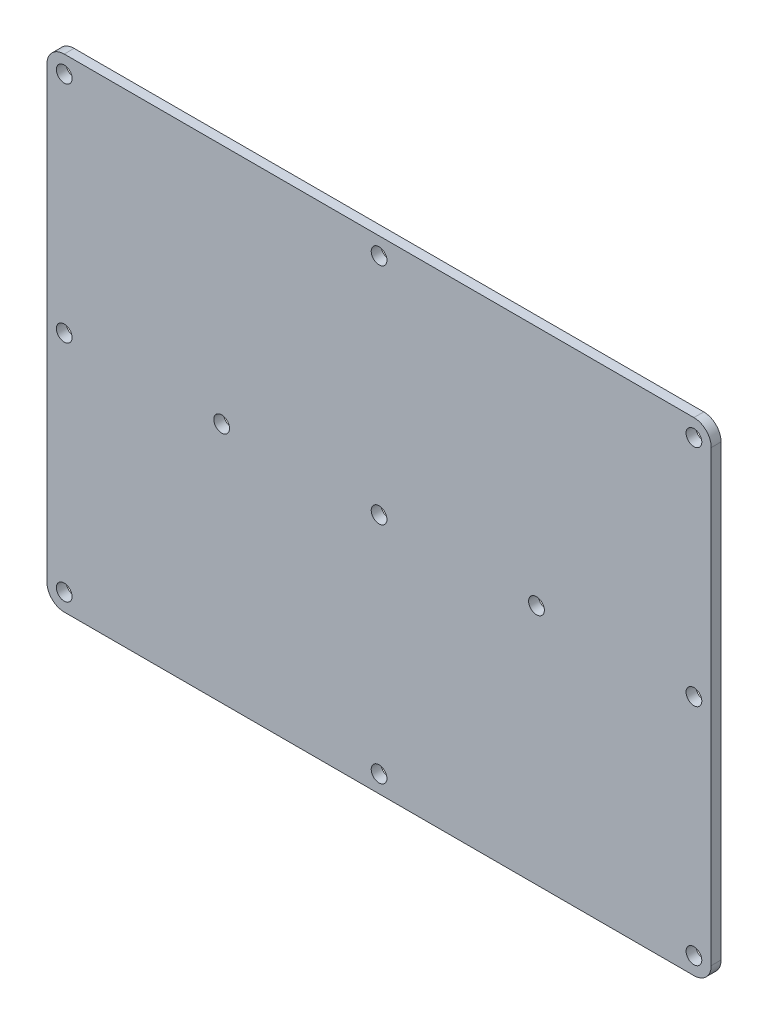
from build123d import *

# Parameters (mm, degrees)
SKETCH1_R           = 2.54
BOSS_EXTRUDE1_DEPTH = 3.175


with BuildPart() as part:
    # Sketch1 → Boss-Extrude1 (new body)
    with BuildSketch(Plane.XY):
        with BuildLine():
            Line((-101.6, 77.978), (101.6, 77.978))
            ThreePointArc((101.6, 77.978), (105.551312693, 76.341312693), (107.188, 72.39))
            Line((107.188, 72.39), (107.188, 24.765))
            Line((107.188, 24.765), (107.188, -24.765))
            Line((107.188, -24.765), (107.188, -72.39))
            ThreePointArc((107.188, -72.39), (105.551312693, -76.341312693), (101.6, -77.978))
            Line((101.6, -77.978), (-101.6, -77.978))
            ThreePointArc((-101.6, -77.978), (-105.551312693, -76.341312693), (-107.188, -72.39))
            Line((-107.188, -72.39), (-107.188, -24.765))
            Line((-107.188, -24.765), (-107.188, 24.765))
            Line((-107.188, 24.765), (-107.188, 72.39))
            ThreePointArc((-107.188, 72.39), (-105.551312693, 76.341312693), (-101.6, 77.978))
        make_face()
        with Locations((-101.6, 0)):
            Circle(SKETCH1_R, mode=Mode.SUBTRACT)
        with Locations((-50.8, 0)):
            Circle(SKETCH1_R, mode=Mode.SUBTRACT)
        Circle(SKETCH1_R, mode=Mode.SUBTRACT)
        with Locations((101.6, 0)):
            Circle(SKETCH1_R, mode=Mode.SUBTRACT)
        with Locations((50.8, 0)):
            Circle(SKETCH1_R, mode=Mode.SUBTRACT)
        with Locations((-101.6, 72.39)):
            Circle(SKETCH1_R, mode=Mode.SUBTRACT)
        with Locations((0, 72.39)):
            Circle(SKETCH1_R, mode=Mode.SUBTRACT)
        with Locations((101.6, 72.39)):
            Circle(SKETCH1_R, mode=Mode.SUBTRACT)
        with Locations((-101.6, -72.39)):
            Circle(SKETCH1_R, mode=Mode.SUBTRACT)
        with Locations((0, -72.39)):
            Circle(SKETCH1_R, mode=Mode.SUBTRACT)
        with Locations((101.6, -72.39)):
            Circle(SKETCH1_R, mode=Mode.SUBTRACT)
    extrude(amount=BOSS_EXTRUDE1_DEPTH)


solid = part.part
